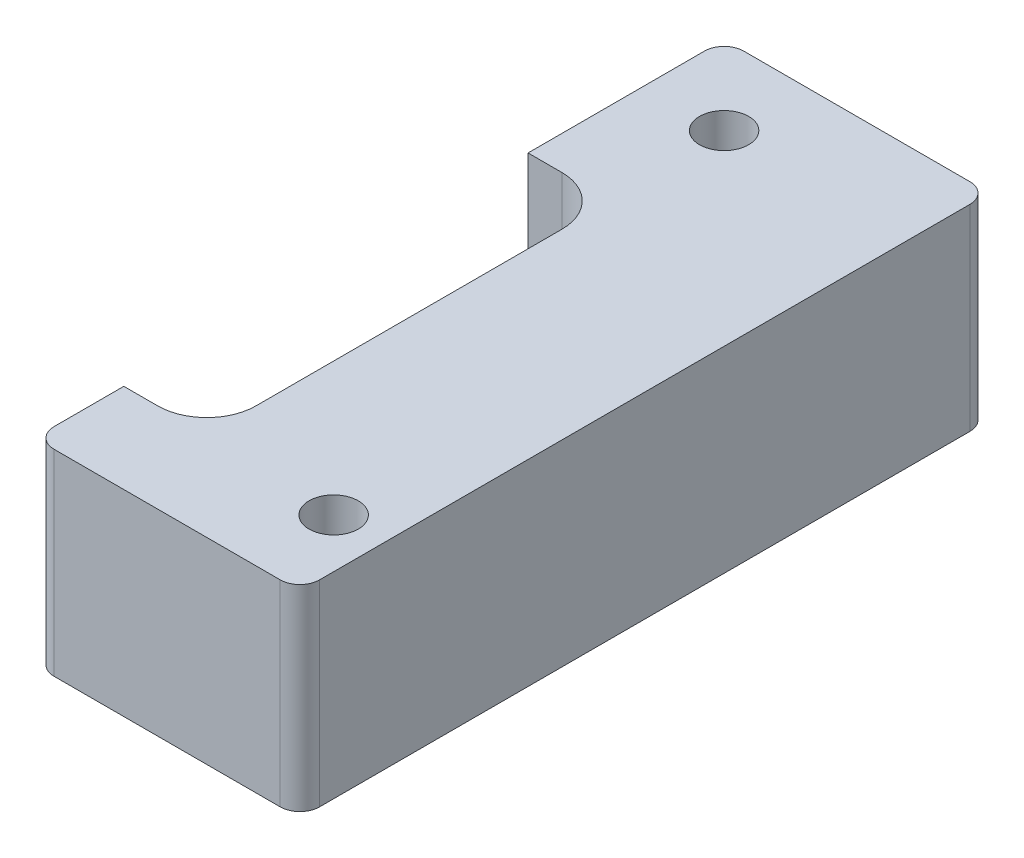
from build123d import *

# Parameters (mm, degrees)
SKETCH_1_R         = 1.25
EXTRUDE_2_DEPTH    = 10
SKETCH1_W          = 5.221315892
SKETCH1_H          = 20.556
CUT_EXTRUDE1_DEPTH = 10
FILLET1_R          = 1
FILLET2_R          = 2.5


with BuildPart() as part:
    # Эскиз1 → Бобышка-Вытянуть2 (new body)
    with BuildSketch(Plane(origin=(0, 0, 0), x_dir=(1, 0, 0), z_dir=(0, 1, 0))):
        with BuildLine():
            Line((-6.75, -16.533718228), (-6.75, -17.533718228))
            Line((-6.75, -17.533718228), (1.25, -17.533718228))
            Line((1.25, -17.533718228), (5.75, -17.533718228))
            ThreePointArc((5.75, -17.533718228), (6.457106781, -17.240825009), (6.75, -16.533718228))
            Line((6.75, -16.533718228), (6.75, 16.538507887))
            ThreePointArc((6.75, 16.538507887), (6.457106781, 17.245614668), (5.75, 17.538507887))
            Line((5.75, 17.538507887), (-5.75, 17.538507887))
            ThreePointArc((-5.75, 17.538507887), (-6.457106781, 17.245614668), (-6.75, 16.538507887))
            Line((-6.75, 16.538507887), (-6.75, 5.538507887))
            ThreePointArc((-6.75, 5.538507887), (-6.457106781, 4.831401106), (-5.75, 4.538507887))
            Line((-5.75, 4.538507887), (-5.746697715, 4.538507887))
            ThreePointArc((-5.746697715, 4.538507887), (-5.039590934, 4.245614668), (-4.746697715, 3.538507887))
            Line((-4.746697715, 3.538507887), (-4.746697715, -8.461492113))
            ThreePointArc((-4.746697715, -8.461492113), (-5.039590934, -9.168598894), (-5.746697715, -9.461492113))
            Line((-5.746697715, -9.461492113), (-5.75, -9.461492113))
            ThreePointArc((-5.75, -9.461492113), (-6.457106781, -9.754385332), (-6.75, -10.461492113))
            Line((-6.75, -10.461492113), (-6.75, -16.533718228))
        make_face()
        with Locations(Location((-2.75, 13.538507887, 0), (0, 0, 270))):
            Circle(SKETCH_1_R, mode=Mode.SUBTRACT)
        with Locations(Location((4.25, -13.316820051, 0), (0, 0, 270))):
            Circle(SKETCH_1_R, mode=Mode.SUBTRACT)
    extrude(amount=EXTRUDE_2_DEPTH)

    # Sketch1 → Cut-Extrude1 (cut)
    with BuildSketch(Plane.XZ):
        with Locations((-5.139342054, 2.709492113)):
            Rectangle(SKETCH1_W, SKETCH1_H)
    extrude(amount=-CUT_EXTRUDE1_DEPTH, mode=Mode.SUBTRACT)

    # Fillet1
    fillet1_edges = [part.edges().sort_by_distance(p)[0] for p in [
        (-6.75, 5, 17.533718228),
    ]]
    fillet(fillet1_edges, radius=FILLET1_R)

    # Fillet2
    fillet2_edges = [part.edges().sort_by_distance(p)[0] for p in [
        (-2.528684108, 5, -7.568507887),
        (-2.528684108, 5, 12.987492113),
    ]]
    fillet(fillet2_edges, radius=FILLET2_R)


solid = part.part
